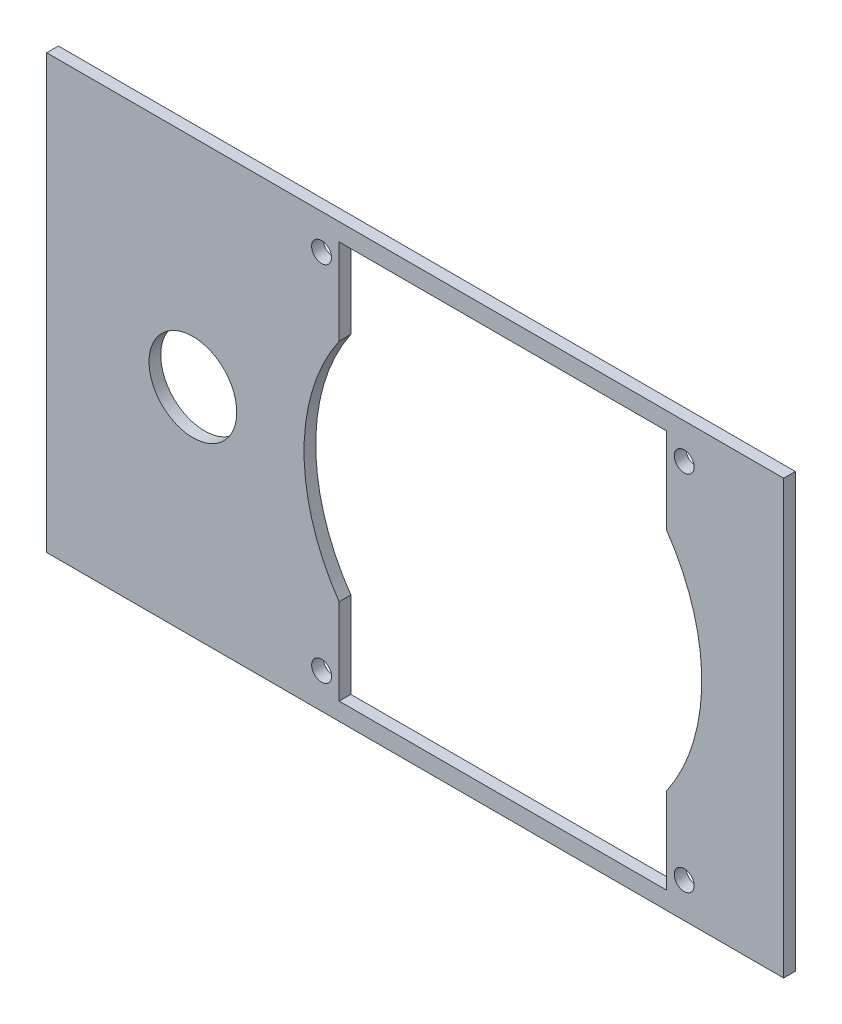
from build123d import *

# Parameters (mm, degrees)
ESBO_O1_W                = 126
ESBO_O1_H                = 74
ESBO_O1_R                = 1.7
ESBO_O1_R_2              = 7.5
RESSALTO_EXTRUS_O1_DEPTH = 2


with BuildPart() as part:
    # Esboço1 → Ressalto-extrusão1 (new body)
    with BuildSketch(Plane.XY):
        with Locations((63, -37)):
            Rectangle(ESBO_O1_W, ESBO_O1_H)
        with Locations((47, -6)):
            Circle(ESBO_O1_R, mode=Mode.SUBTRACT)
        with Locations((109, -6)):
            Circle(ESBO_O1_R, mode=Mode.SUBTRACT)
        with Locations((47, -68)):
            Circle(ESBO_O1_R, mode=Mode.SUBTRACT)
        with Locations((109, -68)):
            Circle(ESBO_O1_R, mode=Mode.SUBTRACT)
        with Locations((25, -37)):
            Circle(ESBO_O1_R_2, mode=Mode.SUBTRACT)
        with BuildLine():
            Line((50, -3), (50, -17.712698478))
            ThreePointArc((50, -17.712698478), (44, -37), (50, -56.287301522))
            Line((50, -56.287301522), (50, -71))
            Line((50, -71), (106, -71))
            Line((106, -71), (106, -56.287301522))
            ThreePointArc((106, -56.287301522), (112, -37), (106, -17.712698478))
            Line((106, -17.712698478), (106, -3))
            Line((106, -3), (50, -3))
        make_face(mode=Mode.SUBTRACT)
    extrude(amount=RESSALTO_EXTRUS_O1_DEPTH)


solid = part.part
